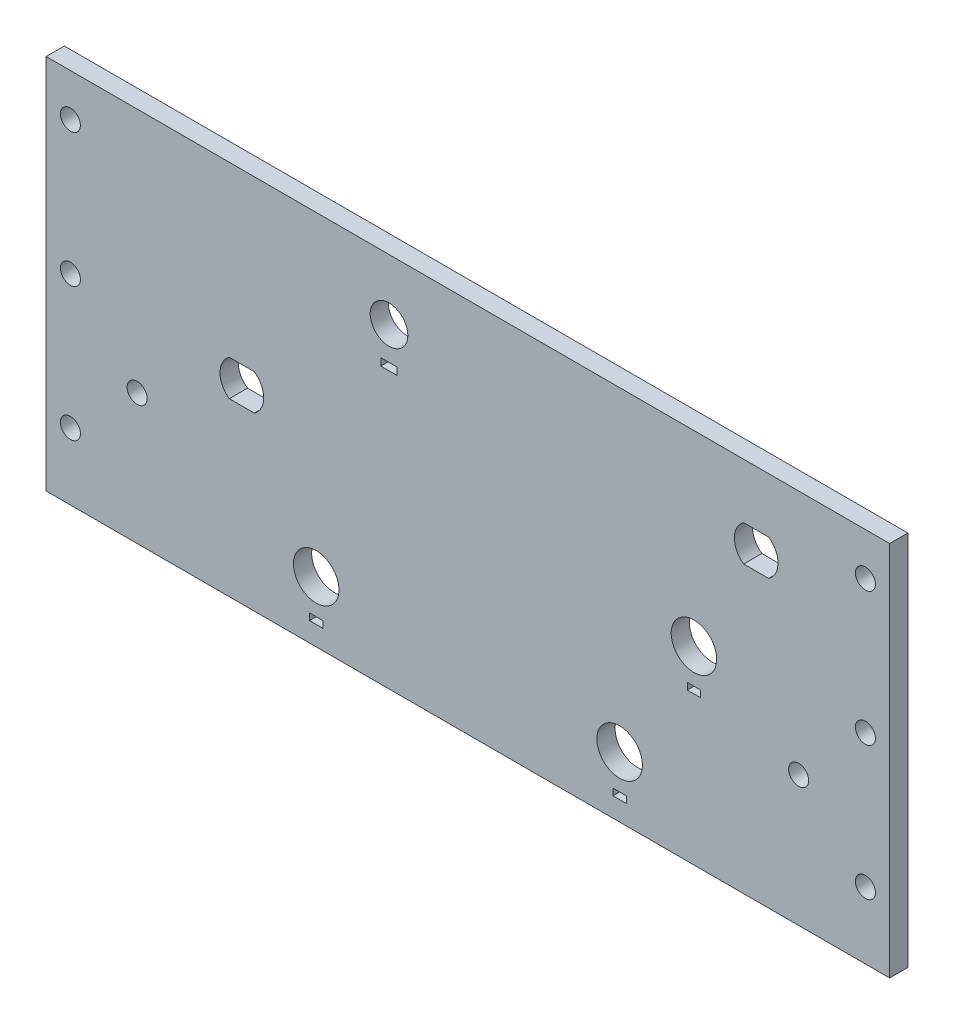
from build123d import *

# Parameters (mm, degrees)
SKETCH1_W           = 139
SKETCH1_H           = 62
SKETCH1_R           = 3.75
SKETCH1_R_2         = 1.65
SKETCH1_R_3         = 3.1
SKETCH1_W_2         = 2.2
SKETCH1_H_2         = 1.1
SKETCH1_W_3         = 2.7
SKETCH1_H_3         = 1.2
BOSS_EXTRUDE1_DEPTH = 3


with BuildPart() as part:
    # Sketch1 → Boss-Extrude1 (new body)
    with BuildSketch(Plane.XY):
        with Locations((69.5, 31)):
            Rectangle(SKETCH1_W, SKETCH1_H)
        with Locations((94.5, 10)):
            Circle(SKETCH1_R, mode=Mode.SUBTRACT)
        with Locations((4, 33)):
            Circle(SKETCH1_R_2, mode=Mode.SUBTRACT)
        with Locations((135, 33)):
            Circle(SKETCH1_R_2, mode=Mode.SUBTRACT)
        with Locations((135, 11)):
            Circle(SKETCH1_R_2, mode=Mode.SUBTRACT)
        with Locations((4, 11)):
            Circle(SKETCH1_R_2, mode=Mode.SUBTRACT)
        with Locations((106.75, 31.217622393)):
            Circle(SKETCH1_R, mode=Mode.SUBTRACT)
        with Locations((124, 21.5)):
            Circle(SKETCH1_R_2, mode=Mode.SUBTRACT)
        with Locations((44.5, 10)):
            Circle(SKETCH1_R, mode=Mode.SUBTRACT)
        with Locations(Location((15, 21.5, 0), (0, 0, 180))):
            Circle(SKETCH1_R_2, mode=Mode.SUBTRACT)
        with Locations((56.5, 52)):
            Circle(SKETCH1_R_3, mode=Mode.SUBTRACT)
        with Locations((4, 55)):
            Circle(SKETCH1_R_2, mode=Mode.SUBTRACT)
        with Locations((135, 55)):
            Circle(SKETCH1_R_2, mode=Mode.SUBTRACT)
        with Locations((44.5, 3.75)):
            Rectangle(SKETCH1_W_2, SKETCH1_H_2, mode=Mode.SUBTRACT)
        with Locations((94.5, 3.75)):
            Rectangle(SKETCH1_W_2, SKETCH1_H_2, mode=Mode.SUBTRACT)
        with Locations((106.75, 24.967622393)):
            Rectangle(SKETCH1_W_2, SKETCH1_H_2, mode=Mode.SUBTRACT)
        with Locations((56.5, 46)):
            Rectangle(SKETCH1_W_3, SKETCH1_H_3, mode=Mode.SUBTRACT)
        with BuildLine():
            Line((114.936628972, 47.05), (119.063371028, 47.05))
            ThreePointArc((119.063371028, 47.05), (120.6, 50), (119.063371028, 52.95))
            Line((119.063371028, 52.95), (114.936628972, 52.95))
            ThreePointArc((114.936628972, 52.95), (113.4, 50), (114.936628972, 47.05))
        make_face(mode=Mode.SUBTRACT)
        with BuildLine():
            Line((30.186628972, 28.267622393), (34.313371028, 28.267622393))
            ThreePointArc((34.313371028, 28.267622393), (35.85, 31.217622393), (34.313371028, 34.167622393))
            Line((34.313371028, 34.167622393), (30.186628972, 34.167622393))
            ThreePointArc((30.186628972, 34.167622393), (28.65, 31.217622393), (30.186628972, 28.267622393))
        make_face(mode=Mode.SUBTRACT)
    extrude(amount=BOSS_EXTRUDE1_DEPTH)


solid = part.part
